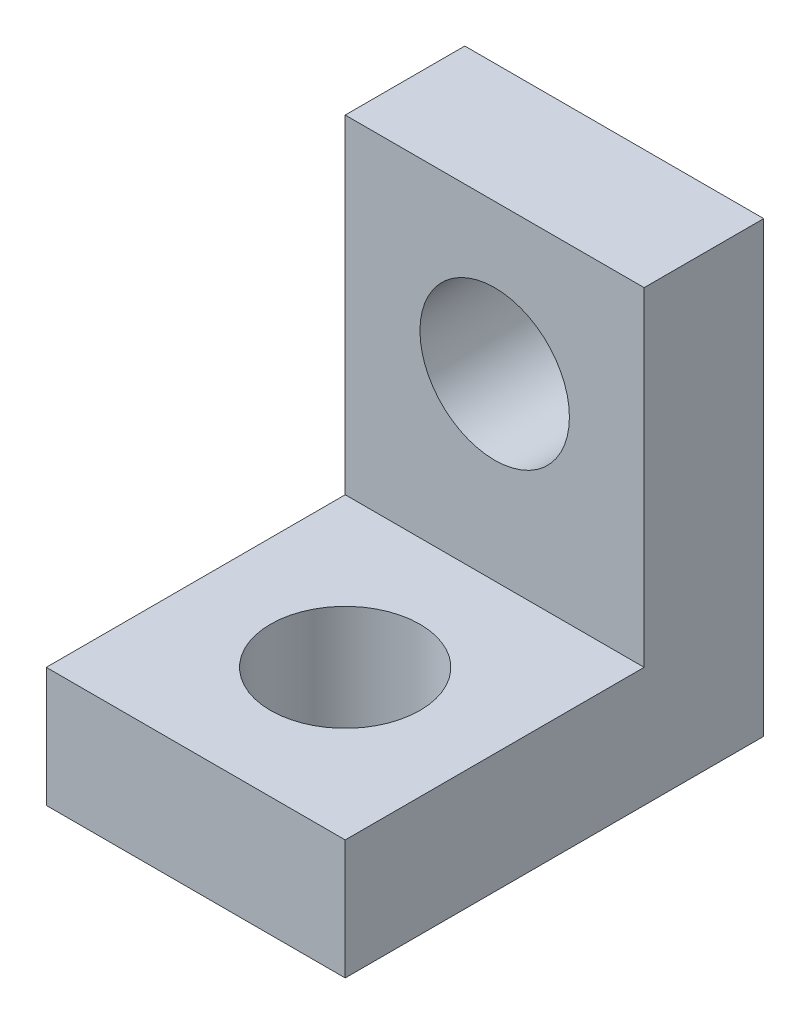
from build123d import *

# Parameters (mm, degrees)
SKETCH1_W           = 10
SKETCH1_H           = 15
SKETCH1_R           = 2.5
BOSS_EXTRUDE1_DEPTH = 4
SKETCH2_W           = 10
SKETCH2_H           = 4
BOSS_EXTRUDE2_DEPTH = 10
SKETCH3_R           = 2.5
CUT_EXTRUDE1_DEPTH  = 10


with BuildPart() as part:
    # Sketch1 → Boss-Extrude1 (new body)
    with BuildSketch(Plane.XY):
        Rectangle(SKETCH1_W, SKETCH1_H)
        with Locations((0, 2.5)):
            Circle(SKETCH1_R, mode=Mode.SUBTRACT)
    extrude(amount=BOSS_EXTRUDE1_DEPTH)

    # Sketch2 → Boss-Extrude2 (add)
    with BuildSketch(Plane.XY.offset(4)):
        with Locations((0, -5.5)):
            Rectangle(SKETCH2_W, SKETCH2_H)
    extrude(amount=BOSS_EXTRUDE2_DEPTH)

    # Sketch3 → Cut-Extrude1 (cut)
    with BuildSketch(Plane(origin=(0, -3.5, 0), x_dir=(1, 0, 0), z_dir=(0, 1, 0))):
        with Locations(Location((0, -9, 0), (0, 0, 270))):
            Circle(SKETCH3_R)
    extrude(amount=-CUT_EXTRUDE1_DEPTH, mode=Mode.SUBTRACT)


solid = part.part
